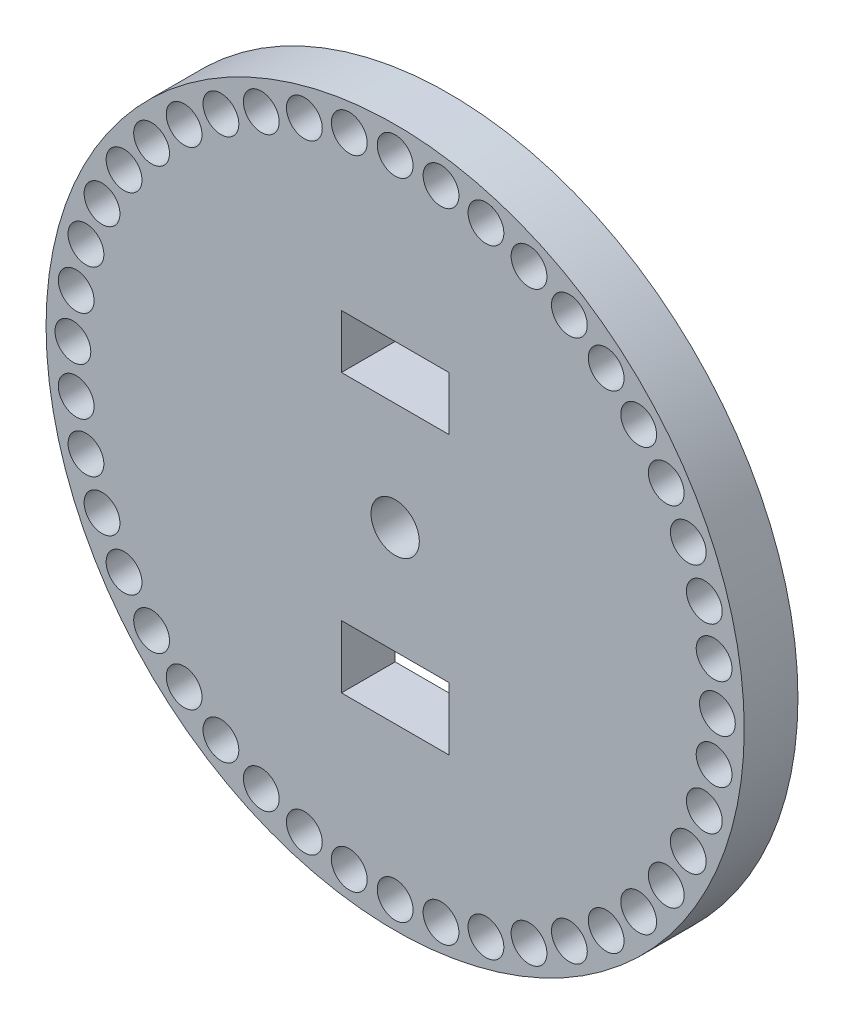
from build123d import *

# Parameters (mm, degrees)
SKETCH1_R           = 19.5
BOSS_EXTRUDE1_DEPTH = 3
SKETCH6_R           = 1
CUT_EXTRUDE3_DEPTH  = 3
SKETCH7_R           = 1.35
CUT_EXTRUDE4_DEPTH  = 3
SKETCH10_W          = 6
SKETCH10_H          = 3
SKETCH10_H_2        = 3.5
CUT_EXTRUDE5_DEPTH  = 3


with BuildPart() as part:
    # Sketch1 → Boss-Extrude1 (new body)
    with BuildSketch(Plane.XY):
        Circle(SKETCH1_R)
    extrude(amount=BOSS_EXTRUDE1_DEPTH)

    # Sketch6 → Cut-Extrude3 (cut)
    with BuildSketch(Plane.XY.offset(3)):
        with Locations((0, 18)):
            Circle(SKETCH6_R)
        with Locations((2.561667089, 17.816785954)):
            Circle(SKETCH6_R)
        with Locations((5.071186023, 17.270873525)):
            Circle(SKETCH6_R)
        with Locations((7.477470234, 16.373375916)):
            Circle(SKETCH6_R)
        with Locations((9.731534714, 15.142563591)):
            Circle(SKETCH6_R)
        with Locations((11.787493211, 13.603492338)):
            Circle(SKETCH6_R)
        with Locations((13.603492338, 11.787493211)):
            Circle(SKETCH6_R)
        with Locations((15.142563591, 9.731534714)):
            Circle(SKETCH6_R)
        with Locations((16.373375916, 7.477470234)):
            Circle(SKETCH6_R)
        with Locations((17.270873525, 5.071186023)):
            Circle(SKETCH6_R)
        with Locations((17.816785954, 2.561667089)):
            Circle(SKETCH6_R)
        with Locations((18, 0)):
            Circle(SKETCH6_R)
        with Locations((17.816785954, -2.561667089)):
            Circle(SKETCH6_R)
        with Locations((17.270873525, -5.071186023)):
            Circle(SKETCH6_R)
        with Locations((16.373375916, -7.477470234)):
            Circle(SKETCH6_R)
        with Locations((15.142563591, -9.731534714)):
            Circle(SKETCH6_R)
        with Locations((13.603492338, -11.787493211)):
            Circle(SKETCH6_R)
        with Locations((11.787493211, -13.603492338)):
            Circle(SKETCH6_R)
        with Locations((9.731534714, -15.142563591)):
            Circle(SKETCH6_R)
        with Locations((7.477470234, -16.373375916)):
            Circle(SKETCH6_R)
        with Locations((5.071186023, -17.270873525)):
            Circle(SKETCH6_R)
        with Locations((2.561667089, -17.816785954)):
            Circle(SKETCH6_R)
        with Locations((0, -18)):
            Circle(SKETCH6_R)
        with Locations((-2.561667089, -17.816785954)):
            Circle(SKETCH6_R)
        with Locations((-5.071186023, -17.270873525)):
            Circle(SKETCH6_R)
        with Locations((-7.477470234, -16.373375916)):
            Circle(SKETCH6_R)
        with Locations((-9.731534714, -15.142563591)):
            Circle(SKETCH6_R)
        with Locations((-11.787493211, -13.603492338)):
            Circle(SKETCH6_R)
        with Locations((-13.603492338, -11.787493211)):
            Circle(SKETCH6_R)
        with Locations((-15.142563591, -9.731534714)):
            Circle(SKETCH6_R)
        with Locations((-16.373375916, -7.477470234)):
            Circle(SKETCH6_R)
        with Locations((-17.270873525, -5.071186023)):
            Circle(SKETCH6_R)
        with Locations((-17.816785954, -2.561667089)):
            Circle(SKETCH6_R)
        with Locations((-18, 0)):
            Circle(SKETCH6_R)
        with Locations((-17.816785954, 2.561667089)):
            Circle(SKETCH6_R)
        with Locations((-17.270873525, 5.071186023)):
            Circle(SKETCH6_R)
        with Locations((-16.373375916, 7.477470234)):
            Circle(SKETCH6_R)
        with Locations((-15.142563591, 9.731534714)):
            Circle(SKETCH6_R)
        with Locations((-13.603492338, 11.787493211)):
            Circle(SKETCH6_R)
        with Locations((-11.787493211, 13.603492338)):
            Circle(SKETCH6_R)
        with Locations((-9.731534714, 15.142563591)):
            Circle(SKETCH6_R)
        with Locations((-7.477470234, 16.373375916)):
            Circle(SKETCH6_R)
        with Locations((-5.071186023, 17.270873525)):
            Circle(SKETCH6_R)
        with Locations((-2.561667089, 17.816785954)):
            Circle(SKETCH6_R)
    extrude(amount=-CUT_EXTRUDE3_DEPTH, mode=Mode.SUBTRACT)

    # Sketch7 → Cut-Extrude4 (cut)
    with BuildSketch(Plane.XY.offset(3)):
        Circle(SKETCH7_R)
    extrude(amount=-CUT_EXTRUDE4_DEPTH, mode=Mode.SUBTRACT)

    # Sketch10 → Cut-Extrude5 (cut)
    with BuildSketch(Plane.XY.offset(3)):
        with Locations((0, 7.5)):
            Rectangle(SKETCH10_W, SKETCH10_H)
        with Locations((0, -7.75)):
            Rectangle(SKETCH10_W, SKETCH10_H_2)
    extrude(amount=-CUT_EXTRUDE5_DEPTH, mode=Mode.SUBTRACT)


solid = part.part
